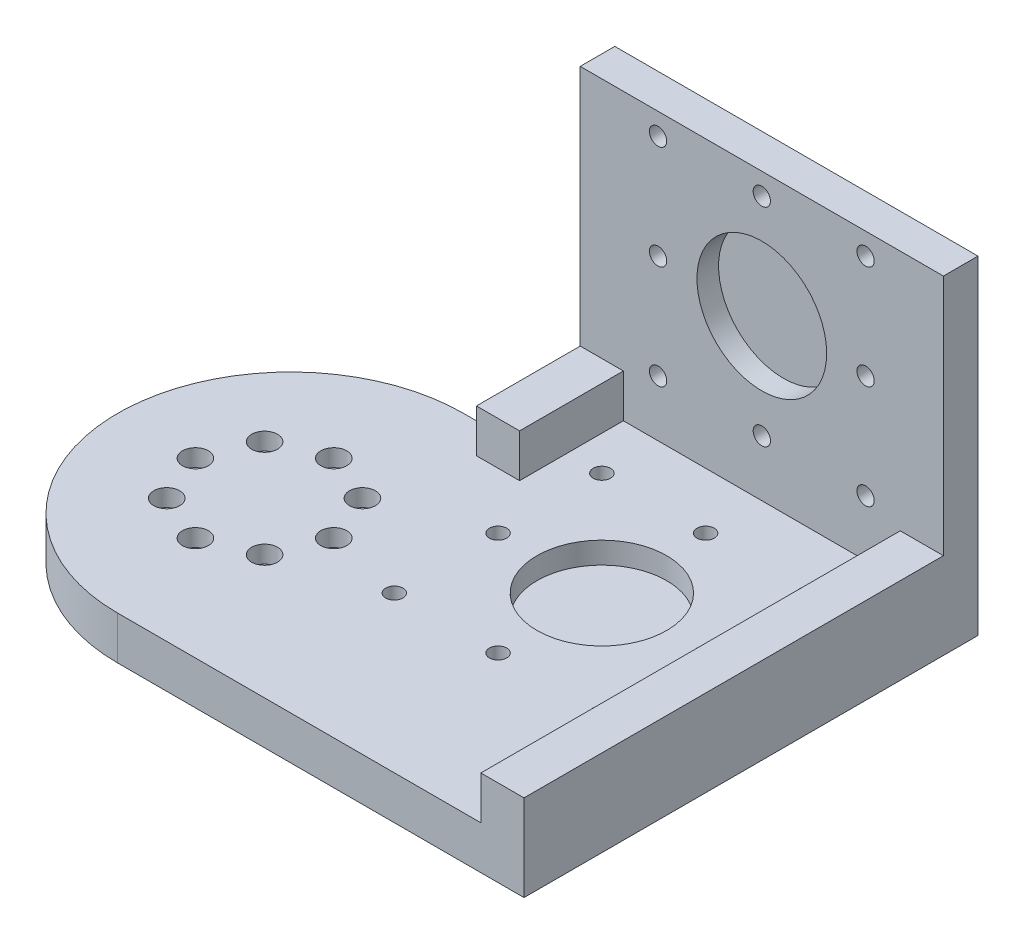
from build123d import *

# Parameters (mm, degrees)
SKETCH1_W            = 58
SKETCH1_H            = 58
SKETCH1_R            = 2
BOSS_EXTRUDE1_DEPTH  = 8
SKETCH13_R           = 15
CUT_EXTRUDE5_DEPTH   = 5
BOSS_EXTRUDE7_DEPTH  = 8
SKETCH21_W           = 84
SKETCH21_H           = 10
BOSS_EXTRUDE8_DEPTH  = 114
SKETCH22_W           = 9.98
SKETCH22_H           = 9.98
BOSS_EXTRUDE9_DEPTH  = 114
BOSS_EXTRUDE10_DEPTH = 10
SKETCH27_W           = 84
SKETCH27_H           = 17
CUT_EXTRUDE9_DEPTH   = 160.865568526
SKETCH28_R           = 2
CUT_EXTRUDE10_DEPTH  = 155.418263169
SKETCH29_R           = 3
CUT_EXTRUDE11_DEPTH  = 4
SKETCH31_W           = 9.98
SKETCH31_H           = 9.98
BOSS_EXTRUDE11_DEPTH = 24
SKETCH36_R           = 2
SKETCH36_R_2         = 15
CUT_EXTRUDE12_DEPTH  = 20
SKETCH37_R           = 15
BOSS_EXTRUDE12_DEPTH = 5


with BuildPart() as part:
    # Sketch1 → Boss-Extrude1 (new body)
    with BuildSketch(Plane.XY):
        Rectangle(SKETCH1_W, SKETCH1_H)
        with Locations((0, 24)):
            Circle(SKETCH1_R, mode=Mode.SUBTRACT)
        with Locations((-24, 24)):
            Circle(SKETCH1_R, mode=Mode.SUBTRACT)
        with Locations((24, 0)):
            Circle(SKETCH1_R, mode=Mode.SUBTRACT)
        with Locations((0, -24)):
            Circle(SKETCH1_R, mode=Mode.SUBTRACT)
        with Locations((-24, 0)):
            Circle(SKETCH1_R, mode=Mode.SUBTRACT)
        with Locations(Location((24, -24, 0), (0, 0, 180))):
            Circle(SKETCH1_R, mode=Mode.SUBTRACT)
        with Locations((24, 24)):
            Circle(SKETCH1_R, mode=Mode.SUBTRACT)
        with Locations(Location((-24, -24, 0), (0, 0, 180))):
            Circle(SKETCH1_R, mode=Mode.SUBTRACT)
    extrude(amount=BOSS_EXTRUDE1_DEPTH)

    # Sketch13 → Cut-Extrude5 (cut)
    with BuildSketch(Plane.XY.offset(8)):
        Circle(SKETCH13_R)
    extrude(amount=-CUT_EXTRUDE5_DEPTH, mode=Mode.SUBTRACT)

    # Sketch15 → Boss-Extrude7 (add)
    with BuildSketch(Plane.XY):
        Polygon((29, -29), (-29, -29), (-29, 29), (-42, 29), (-42, -29), (-42, -47), (42, -47), (42, -29), (42, 29), (29, 29), align=None)
    extrude(amount=BOSS_EXTRUDE7_DEPTH)

    # Sketch21 → Boss-Extrude8 (add)
    with BuildSketch(Plane.XY.offset(8)):
        with Locations((0, -42)):
            Rectangle(SKETCH21_W, SKETCH21_H)
    extrude(amount=BOSS_EXTRUDE8_DEPTH)

    # Sketch22 → Boss-Extrude9 (add)
    with BuildSketch(Plane.XY.offset(8)):
        with Locations((37.01, -32.01)):
            Rectangle(SKETCH22_W, SKETCH22_H)
    extrude(amount=BOSS_EXTRUDE9_DEPTH)

    # Sketch23 → Boss-Extrude10 (add)
    with BuildSketch(Plane(origin=(0, -37, 0), x_dir=(1, 0, 0), z_dir=(0, 1, 0))):
        with BuildLine():
            Line((-52, -105), (-32.937047874, -105))
            Line((-32.937047874, -105), (-32.937047874, -25))
            Line((-32.937047874, -25), (-52, -25))
            ThreePointArc((-52, -25), (-92, -65), (-52, -105))
        make_face()
    extrude(amount=-BOSS_EXTRUDE10_DEPTH)

    # Sketch27 → Cut-Extrude9 (cut, through all)
    with BuildSketch(Plane(origin=(0, 0, 0), x_dir=(1, 0, 0), z_dir=(0, 1, 0))):
        with Locations((0, -113.5)):
            Rectangle(SKETCH27_W, SKETCH27_H)
    extrude(amount=-CUT_EXTRUDE9_DEPTH, mode=Mode.SUBTRACT)

    # Sketch28 → Cut-Extrude10 (cut, through all)
    with BuildSketch(Plane(origin=(0, -37, 0), x_dir=(1, 0, 0), z_dir=(0, 1, 0))):
        with Locations(Location((-42, -65, 0), (0, 0, 270))):
            Circle(SKETCH28_R)
        with Locations(Location((-46.686291501, -76.313708499, 0), (0, 0, 270))):
            Circle(SKETCH28_R)
        with Locations(Location((-58, -81, 0), (0, 0, 270))):
            Circle(SKETCH28_R)
        with Locations(Location((-69.313708499, -76.313708499, 0), (0, 0, 270))):
            Circle(SKETCH28_R)
        with Locations(Location((-74, -65, 0), (0, 0, 270))):
            Circle(SKETCH28_R)
        with Locations(Location((-69.313708499, -53.686291501, 0), (0, 0, 270))):
            Circle(SKETCH28_R)
        with Locations(Location((-58, -49, 0), (0, 0, 270))):
            Circle(SKETCH28_R)
        with Locations(Location((-46.686291501, -53.686291501, 0), (0, 0, 270))):
            Circle(SKETCH28_R)
    extrude(amount=-CUT_EXTRUDE10_DEPTH, mode=Mode.SUBTRACT)

    # Sketch29 → Cut-Extrude11 (cut)
    with BuildSketch(Plane(origin=(0, -37, 0), x_dir=(1, 0, 0), z_dir=(0, 1, 0))):
        with Locations(Location((-58, -49, 0), (0, 0, 270))):
            Circle(SKETCH29_R)
        with Locations(Location((-46.686291501, -53.686291501, 0), (0, 0, 270))):
            Circle(SKETCH29_R)
        with Locations(Location((-42, -65, 0), (0, 0, 270))):
            Circle(SKETCH29_R)
        with Locations(Location((-46.686291501, -76.313708499, 0), (0, 0, 270))):
            Circle(SKETCH29_R)
        with Locations(Location((-58, -81, 0), (0, 0, 270))):
            Circle(SKETCH29_R)
        with Locations(Location((-69.313708499, -76.313708499, 0), (0, 0, 270))):
            Circle(SKETCH29_R)
        with Locations(Location((-74, -65, 0), (0, 0, 270))):
            Circle(SKETCH29_R)
        with Locations(Location((-69.313708499, -53.686291501, 0), (0, 0, 270))):
            Circle(SKETCH29_R)
    extrude(amount=-CUT_EXTRUDE11_DEPTH, mode=Mode.SUBTRACT)

    # Sketch31 → Boss-Extrude11 (add)
    with BuildSketch(Plane.XY.offset(8)):
        with Locations((-37.01, -32.01)):
            Rectangle(SKETCH31_W, SKETCH31_H)
    extrude(amount=BOSS_EXTRUDE11_DEPTH)

    # Sketch36 → Cut-Extrude12 (cut)
    with BuildSketch(Plane(origin=(0, -37, 0), x_dir=(1, 0, 0), z_dir=(0, 1, 0))):
        with Locations(Location((0, -21, 0), (0, 0, 270))):
            Circle(SKETCH36_R)
        with Locations(Location((24, -45, 0), (0, 0, 270))):
            Circle(SKETCH36_R)
        with Locations(Location((0, -69, 0), (0, 0, 270))):
            Circle(SKETCH36_R)
        with Locations(Location((-24, -45, 0), (0, 0, 270))):
            Circle(SKETCH36_R)
        with Locations(Location((-24, -21, 0), (0, 0, 270))):
            Circle(SKETCH36_R)
        with Locations(Location((24, -21, 0), (0, 0, 270))):
            Circle(SKETCH36_R)
        with Locations(Location((24, -69, 0), (0, 0, 270))):
            Circle(SKETCH36_R)
        with Locations(Location((-24, -69, 0), (0, 0, 270))):
            Circle(SKETCH36_R)
        with Locations(Location((0, -45, 0), (0, 0, 270))):
            Circle(SKETCH36_R_2)
    extrude(amount=-CUT_EXTRUDE12_DEPTH, mode=Mode.SUBTRACT)


with BuildPart() as body_2:
    # Sketch37 → Boss-Extrude12 (new body)
    with BuildSketch(Plane.XZ.offset(47)):
        with Locations(Location((0, 45, 0), (0, 0, 270))):
            Circle(SKETCH37_R)
    extrude(amount=-BOSS_EXTRUDE12_DEPTH)


solid = Compound([part.part, body_2.part])
